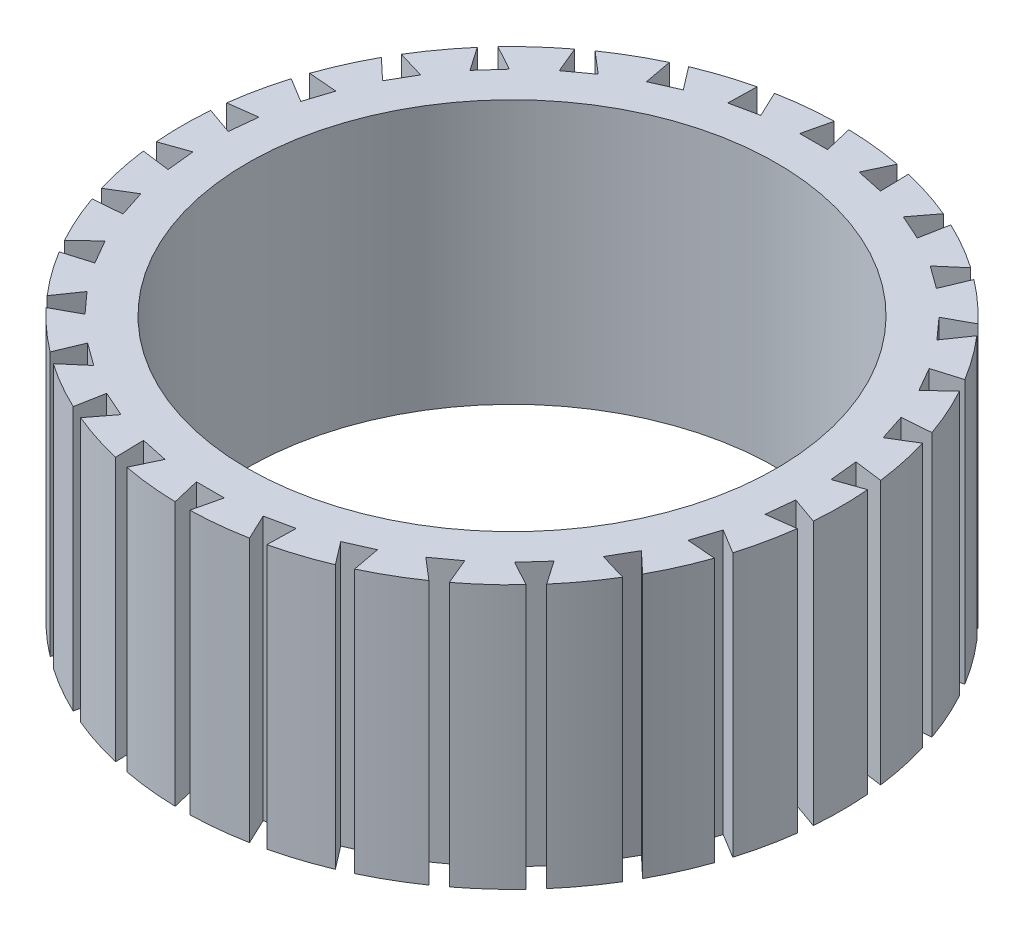
from build123d import *

# Parameters (mm, degrees)
SKETCH1_R           = 16.2
SKETCH1_R_2         = 13
BOSS_EXTRUDE1_DEPTH = 12.9635
CUT_EXTRUDE1_DEPTH  = 27.323607888
CIRPATTERN1_COUNT   = 30


with BuildPart() as part:
    # Sketch1 → Boss-Extrude1 (new body)
    with BuildSketch(Plane(origin=(0, 0, 0), x_dir=(1, 0, 0), z_dir=(0, 1, 0))):
        with Locations(Location((0, 0, 0), (0, 0, 270))):
            Circle(SKETCH1_R)
        with Locations(Location((0, 0, 0), (0, 0, 270))):
            Circle(SKETCH1_R_2, mode=Mode.SUBTRACT)
    extrude(amount=BOSS_EXTRUDE1_DEPTH)

    # Sketch2 → Cut-Extrude1 (cut, through all)
    with BuildSketch(Plane(origin=(0, 0, 0), x_dir=(1, 0, 0), z_dir=(0, 1, 0))):
        Polygon((0.684684655, 14.824655601), (-0.684684655, 14.824655601), (-0.359045792, 16.196020688), (-0.359045792, 18.052836496), (0.359045792, 18.052836496), (0.359045792, 16.196020688), align=None)
    cut_extrude1 = extrude(amount=CUT_EXTRUDE1_DEPTH, mode=Mode.SUBTRACT)

    # CirPattern1: Cut-Extrude1 ×30 about axis
    cirpattern1_axis = Axis((0, 0, 0), (0, 1, 0))
    for i in range(1, CIRPATTERN1_COUNT):
        add(cut_extrude1.rotate(cirpattern1_axis, i * 360 / CIRPATTERN1_COUNT), mode=Mode.SUBTRACT)


solid = part.part
